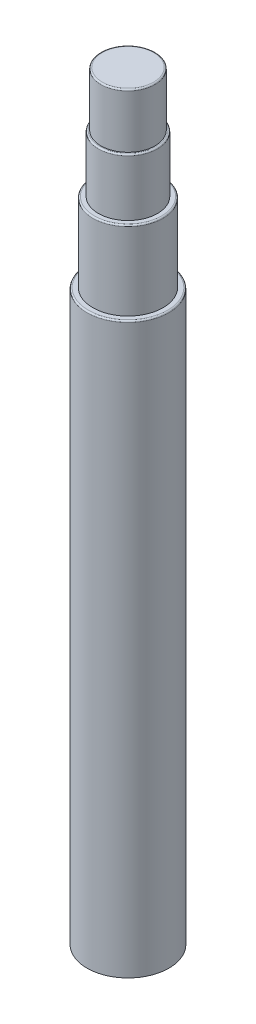
from build123d import *

# Parameters (mm, degrees)
SKETCH1_R           = 28.575
BOSS_EXTRUDE1_DEPTH = 397
SKETCH2_R           = 24.5
BOSS_EXTRUDE2_DEPTH = 55
SKETCH3_R           = 20.64
BOSS_EXTRUDE3_DEPTH = 40
SKETCH4_R           = 18.9
BOSS_EXTRUDE4_DEPTH = 38
FILLET1_R           = 1
SKETCH5_R           = 5
BOSS_EXTRUDE5_DEPTH = 5


with BuildPart() as part:
    # Sketch1 → Boss-Extrude1 (new body)
    with BuildSketch(Plane(origin=(0, 0, 0), x_dir=(1, 0, 0), z_dir=(0, 1, 0))):
        with Locations(Location((0, 0, 0), (0, 0, 270))):
            Circle(SKETCH1_R)
    extrude(amount=BOSS_EXTRUDE1_DEPTH)

    # Sketch2 → Boss-Extrude2 (add)
    with BuildSketch(Plane(origin=(0, 397, 0), x_dir=(1, 0, 0), z_dir=(0, 1, 0))):
        with Locations(Location((0, 0, 0), (0, 0, 270))):
            Circle(SKETCH2_R)
    extrude(amount=BOSS_EXTRUDE2_DEPTH)

    # Sketch3 → Boss-Extrude3 (add)
    with BuildSketch(Plane(origin=(0, 452, 0), x_dir=(1, 0, 0), z_dir=(0, 1, 0))):
        with Locations(Location((0, 0, 0), (0, 0, 270))):
            Circle(SKETCH3_R)
    extrude(amount=BOSS_EXTRUDE3_DEPTH)

    # Sketch4 → Boss-Extrude4 (add)
    with BuildSketch(Plane(origin=(0, 492, 0), x_dir=(1, 0, 0), z_dir=(0, 1, 0))):
        with Locations(Location((0, 0, 0), (0, 0, 270))):
            Circle(SKETCH4_R)
    extrude(amount=BOSS_EXTRUDE4_DEPTH)

    # Fillet1
    fillet1_edges = [part.edges().sort_by_distance(p)[0] for p in [
        (0, 492, -20.64),
        (0, 530, -18.9),
        (0, 397, -28.575),
        (0, 452, -24.5),
    ]]
    fillet(fillet1_edges, radius=FILLET1_R)

    # Sketch5 → Boss-Extrude5 (add)
    with BuildSketch(Plane.XZ):
        with Locations(Location((0, 0, 0), (0, 0, 270))):
            Circle(SKETCH5_R)
    extrude(amount=BOSS_EXTRUDE5_DEPTH)


solid = part.part
